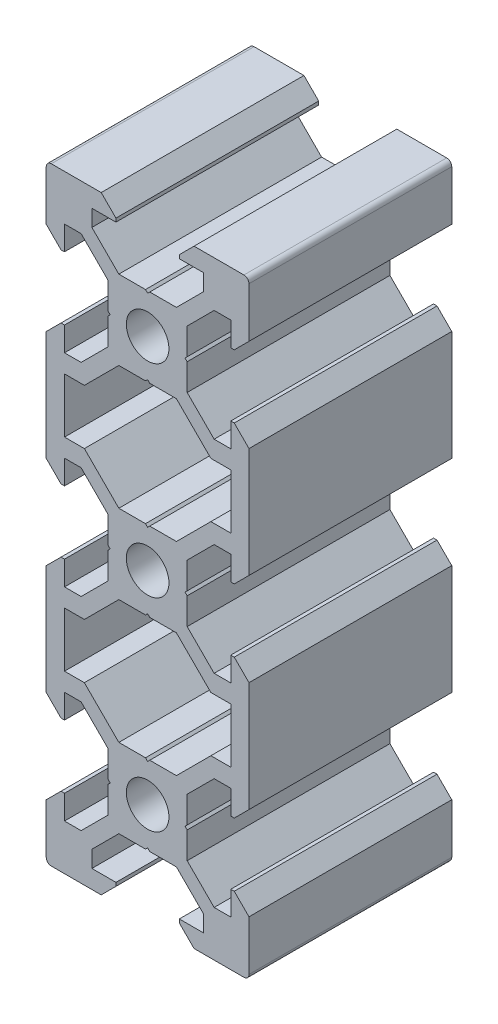
from build123d import *

# Parameters (mm, degrees)
BOSS_EXTRU_1_DEPTH = 20


with BuildPart() as part:
    # Esquisse1 → Boss.-Extru.1 (new body)
    with BuildSketch(Plane.XY):
        with BuildLine():
            Line((-9.5, 10), (-4.58, 10))
            Line((-4.58, 10), (-3.125, 8.545))
            Line((-3.125, 8.545), (-3.125, 8.2))
            Line((-3.125, 8.2), (-5.5, 8.2))
            Line((-5.5, 8.2), (-5.5, 6.560660172))
            Line((-5.5, 6.560660172), (-2.839339828, 3.9))
            Line((-2.839339828, 3.9), (-0.21, 3.9))
            Line((-0.21, 3.9), (0, 3.69))
            Line((0, 3.69), (0, 2.1))
            ThreePointArc((0, 2.1), (-2.1, 0), (0, -2.1))
            Line((0, -2.1), (0, -3.69))
            Line((0, -3.69), (-0.21, -3.9))
            Line((-0.21, -3.9), (-2.839339828, -3.9))
            Line((-2.839339828, -3.9), (-6.239339828, -7.3))
            Line((-6.239339828, -7.3), (-8.2, -7.3))
            Line((-8.2, -7.3), (-8.2, -12.7))
            Line((-8.2, -12.7), (-6.239339828, -12.7))
            Line((-6.239339828, -12.7), (-2.839339828, -16.1))
            Line((-2.839339828, -16.1), (-0.21, -16.1))
            Line((-0.21, -16.1), (0, -16.31))
            Line((0, -16.31), (0, -17.9))
            ThreePointArc((0, -17.9), (-2.1, -20), (0, -22.1))
            Line((0, -22.1), (0, -23.69))
            Line((0, -23.69), (-0.21, -23.9))
            Line((-0.21, -23.9), (-2.839339828, -23.9))
            Line((-2.839339828, -23.9), (-6.239339828, -27.3))
            Line((-6.239339828, -27.3), (-8.2, -27.3))
            Line((-8.2, -27.3), (-8.2, -32.7))
            Line((-8.2, -32.7), (-6.239339828, -32.7))
            Line((-6.239339828, -32.7), (-2.839339828, -36.1))
            Line((-2.839339828, -36.1), (-0.21, -36.1))
            Line((-0.21, -36.1), (0, -36.31))
            Line((0, -36.31), (0, -37.9))
            ThreePointArc((0, -37.9), (-2.1, -40), (0, -42.1))
            Line((0, -42.1), (0, -43.69))
            Line((0, -43.69), (-0.21, -43.9))
            Line((-0.21, -43.9), (-2.839339828, -43.9))
            Line((-2.839339828, -43.9), (-5.5, -46.560660172))
            Line((-5.5, -46.560660172), (-5.5, -48.2))
            Line((-5.5, -48.2), (-3.125, -48.2))
            Line((-3.125, -48.2), (-3.125, -48.545))
            Line((-3.125, -48.545), (-4.58, -50))
            Line((-4.58, -50), (-9.5, -50))
            ThreePointArc((-9.5, -50), (-9.853553391, -49.853553391), (-10, -49.5))
            Line((-10, -49.5), (-10, -44.58))
            Line((-10, -44.58), (-8.545, -43.125))
            Line((-8.545, -43.125), (-8.2, -43.125))
            Line((-8.2, -43.125), (-8.2, -45.5))
            Line((-8.2, -45.5), (-6.560660172, -45.5))
            Line((-6.560660172, -45.5), (-3.9, -42.839339828))
            Line((-3.9, -42.839339828), (-3.9, -40.21))
            Line((-3.9, -40.21), (-3.69, -40))
            Line((-3.69, -40), (-3.9, -39.79))
            Line((-3.9, -39.79), (-3.9, -37.160660172))
            Line((-3.9, -37.160660172), (-6.560660172, -34.5))
            Line((-6.560660172, -34.5), (-8.2, -34.5))
            Line((-8.2, -34.5), (-8.2, -36.875))
            Line((-8.2, -36.875), (-8.545, -36.875))
            Line((-8.545, -36.875), (-10, -35.42))
            Line((-10, -35.42), (-10, -24.58))
            Line((-10, -24.58), (-8.545, -23.125))
            Line((-8.545, -23.125), (-8.2, -23.125))
            Line((-8.2, -23.125), (-8.2, -25.5))
            Line((-8.2, -25.5), (-6.560660172, -25.5))
            Line((-6.560660172, -25.5), (-3.9, -22.839339828))
            Line((-3.9, -22.839339828), (-3.9, -20.21))
            Line((-3.9, -20.21), (-3.69, -20))
            Line((-3.69, -20), (-3.9, -19.79))
            Line((-3.9, -19.79), (-3.9, -17.160660172))
            Line((-3.9, -17.160660172), (-6.560660172, -14.5))
            Line((-6.560660172, -14.5), (-8.2, -14.5))
            Line((-8.2, -14.5), (-8.2, -16.875))
            Line((-8.2, -16.875), (-8.545, -16.875))
            Line((-8.545, -16.875), (-10, -15.42))
            Line((-10, -15.42), (-10, -4.58))
            Line((-10, -4.58), (-8.545, -3.125))
            Line((-8.545, -3.125), (-8.2, -3.125))
            Line((-8.2, -3.125), (-8.2, -5.5))
            Line((-8.2, -5.5), (-6.560660172, -5.5))
            Line((-6.560660172, -5.5), (-3.9, -2.839339828))
            Line((-3.9, -2.839339828), (-3.9, -0.21))
            Line((-3.9, -0.21), (-3.69, 0))
            Line((-3.69, 0), (-3.9, 0.21))
            Line((-3.9, 0.21), (-3.9, 2.839339828))
            Line((-3.9, 2.839339828), (-6.560660172, 5.5))
            Line((-6.560660172, 5.5), (-8.2, 5.5))
            Line((-8.2, 5.5), (-8.2, 3.125))
            Line((-8.2, 3.125), (-8.545, 3.125))
            Line((-8.545, 3.125), (-10, 4.58))
            Line((-10, 4.58), (-10, 9.5))
            ThreePointArc((-10, 9.5), (-9.853553391, 9.853553391), (-9.5, 10))
        make_face()
    boss_extru_1 = extrude(amount=BOSS_EXTRU_1_DEPTH)

    # Symétrie1: Boss.-Extru.1 across plane
    add(boss_extru_1.mirror(Plane(origin=(0, 3.69, 20), x_dir=(0, 0, 1), z_dir=(-1, 0, 0))))


solid = part.part
